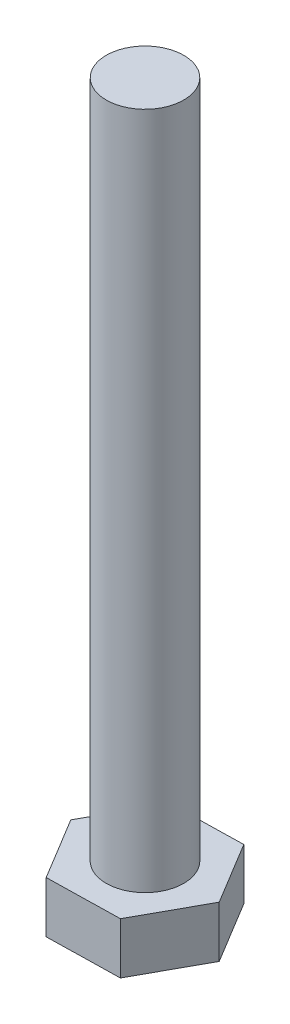
from build123d import *

# Parameters (mm, degrees)
BOSS_EXTRUDE1_DEPTH = 5.3
SKETCH2_R           = 4
BOSS_EXTRUDE2_DEPTH = 70


with BuildPart() as part:
    # Sketch1 → Boss-Extrude1 (new body)
    with BuildSketch(Plane(origin=(0, 0, 0), x_dir=(1, 0, 0), z_dir=(0, 1, 0))):
        Polygon((3.88351853, -6.422742184), (7.504017158, 0.151854611), (3.620498628, 6.574596795), (-3.88351853, 6.422742184), (-7.504017158, -0.151854611), (-3.620498628, -6.574596795), align=None)
    extrude(amount=BOSS_EXTRUDE1_DEPTH)

    # Sketch2 → Boss-Extrude2 (add)
    with BuildSketch(Plane(origin=(0, 5.3, 0), x_dir=(1, 0, 0), z_dir=(0, 1, 0))):
        with Locations(Location((0, 0, 0), (0, 0, 270))):
            Circle(SKETCH2_R)
    extrude(amount=BOSS_EXTRUDE2_DEPTH)


solid = part.part
